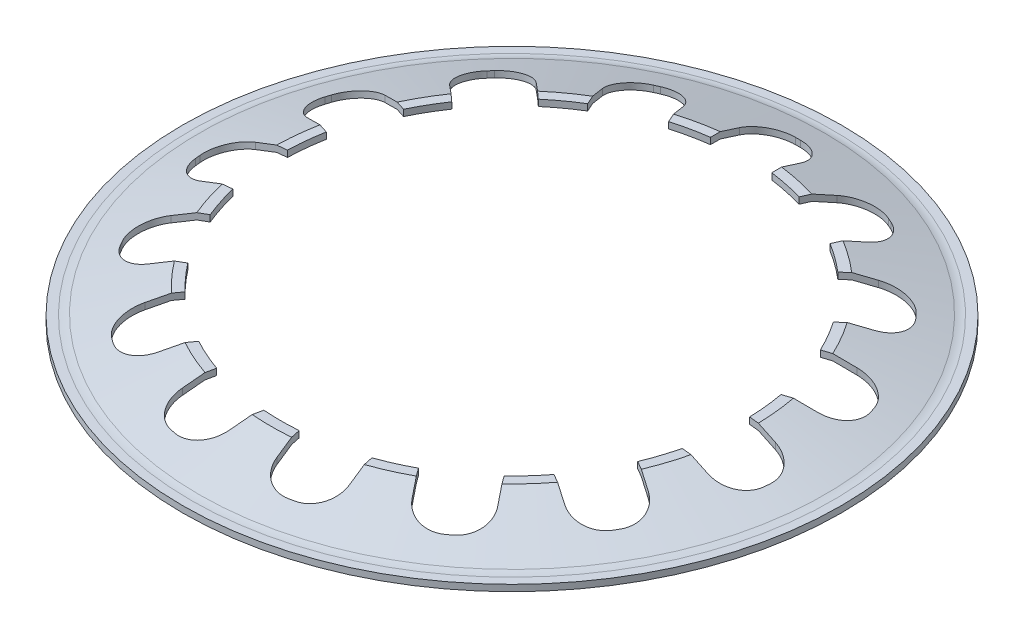
from build123d import *

# Parameters (mm, degrees)
CORTE_EXTRUS_O1_DEPTH = 92.413893911
FILETE1_R             = 5
FILETE2_R             = 5


with BuildPart() as part:
    # Esboço1 → Revolução1 (revolve)
    with BuildSketch(Plane.XY, mode=Mode.PRIVATE) as revolu_o1_sk:
        Polygon((47.15605335, 13.24375812), (62, 8.49375812), (64.5, 8.49375812), (64.5, 9.74375812), (62, 9.74375812), (47.15605335, 14.49375812), (45.25, 14.49375812), (45.25, 13.24375812), align=None)
    revolve(revolu_o1_sk.sketch.rotate(Axis((0, -50.328848283, 0), (0, 1, 0)), 90), axis=Axis((0, -50.328848283, 0), (0, 1, 0)))

    # Esboço3 → Corte-extrusão1 (cut, through all)
    with BuildSketch(Plane(origin=(0, 14.49375812, 0), x_dir=(1, 0, 0), z_dir=(0, 1, 0))):
        with BuildLine():
            Line((-0.5, 56), (0.500000001, 56))
            ThreePointArc((0.500000001, 56), (4.389087298, 54.389087297), (6.000000001, 50.5))
            Line((6.000000001, 50.5), (6.000000001, 40.826188888))
            Line((6.000000001, 40.826188888), (-6, 40.826188888))
            Line((-6, 40.826188888), (-6, 50.5))
            ThreePointArc((-6, 50.5), (-4.389087297, 54.389087297), (-0.5, 56))
        make_face()
        with BuildLine():
            Line((22.320479283, 51.36191395), (23.234024742, 50.955177306))
            ThreePointArc((23.234024742, 50.955177306), (26.131665551, 47.901701011), (26.021473222, 43.693625752))
            Line((26.021473222, 43.693625752), (22.086779765, 34.856159552))
            Line((22.086779765, 34.856159552), (11.124234272, 39.73699927))
            Line((11.124234272, 39.73699927), (15.058927729, 48.574465469))
            ThreePointArc((15.058927729, 48.574465469), (18.112404024, 51.472106278), (22.320479283, 51.36191395))
        make_face()
        with BuildLine():
            Line((41.281544924, 37.842886369), (41.950675531, 37.099741543))
            ThreePointArc((41.950675531, 37.099741543), (43.355841432, 33.131675448), (41.543597325, 29.332226667))
            Line((41.543597325, 29.332226667), (34.354554655, 22.859183572))
            Line((34.354554655, 22.859183572), (26.324987378, 31.776921479))
            Line((26.324987378, 31.776921479), (33.514030048, 38.249964574))
            ThreePointArc((33.514030048, 38.249964574), (37.482096143, 39.655130475), (41.281544924, 37.842886369))
        make_face()
        with BuildLine():
            Line((53.104656415, 17.780479943), (53.41367341, 16.829423426))
            ThreePointArc((53.41367341, 16.829423426), (53.083398453, 12.632882208), (49.882456039, 9.899019117))
            Line((49.882456039, 9.899019117), (40.682114944, 6.909647083))
            Line((40.682114944, 6.909647083), (36.973911011, 18.32232528))
            Line((36.973911011, 18.32232528), (46.174252107, 21.311697314))
            ThreePointArc((46.174252107, 21.311697314), (50.370793324, 20.981422357), (53.104656415, 17.780479943))
        make_face()
        with BuildLine():
            Line((55.745490372, -5.356332995), (55.640961909, -6.350854892))
            ThreePointArc((55.640961909, -6.350854892), (53.632353635, -10.050251132), (49.596184936, -11.245818768))
            Line((49.596184936, -11.245818768), (39.975367974, -10.234630159))
            Line((39.975367974, -10.234630159), (41.229709533, 1.699632587))
            Line((41.229709533, 1.699632587), (50.850526496, 0.688443977))
            ThreePointArc((50.850526496, 0.688443977), (54.549922736, -1.320164297), (55.745490372, -5.356332995))
        make_face()
        with BuildLine():
            Line((48.747422612, -27.566987298), (48.247422611, -28.433012703))
            ThreePointArc((48.247422611, -28.433012703), (44.907787639, -30.995604747), (40.734282891, -30.446152424))
            Line((40.734282891, -30.446152424), (32.356516716, -25.609246868))
            Line((32.356516716, -25.609246868), (38.356516717, -15.216942021))
            Line((38.356516717, -15.216942021), (46.734282891, -20.053847577))
            ThreePointArc((46.734282891, -20.053847577), (49.296874936, -23.39348255), (48.747422612, -27.566987298))
        make_face()
        with BuildLine():
            Line((33.320482626, -45.011059059), (32.51146563, -45.598844312))
            ThreePointArc((32.51146563, -45.598844312), (28.418257185, -46.581536716), (24.829053274, -44.38206973))
            Line((24.829053274, -44.38206973), (19.142929769, -36.55579214))
            Line((19.142929769, -36.55579214), (28.851133702, -29.502369112))
            Line((28.851133702, -29.502369112), (34.537257207, -37.328646702))
            ThreePointArc((34.537257207, -37.328646702), (35.519949611, -41.421855148), (33.320482626, -45.011059059))
        make_face()
        with BuildLine():
            Line((12.132128486, -54.672309796), (11.153980884, -54.880221487))
            ThreePointArc((11.153980884, -54.880221487), (7.014951892, -54.113097806), (4.630654781, -50.643923982))
            Line((4.630654781, -50.643923982), (2.619356356, -41.181508853))
            Line((2.619356356, -41.181508853), (14.357127566, -38.686568563))
            Line((14.357127566, -38.686568563), (16.368425991, -48.148983692))
            ThreePointArc((16.368425991, -48.148983692), (15.60130231, -52.288012684), (12.132128486, -54.672309796))
        make_face()
        with BuildLine():
            Line((-11.153980885, -54.880221487), (-12.132128487, -54.672309795))
            ThreePointArc((-12.132128487, -54.672309795), (-15.601302311, -52.288012684), (-16.368425992, -48.148983692))
            Line((-16.368425992, -48.148983692), (-14.357127567, -38.686568563))
            Line((-14.357127567, -38.686568563), (-2.619356357, -41.181508853))
            Line((-2.619356357, -41.181508853), (-4.630654782, -50.643923982))
            ThreePointArc((-4.630654782, -50.643923982), (-7.014951893, -54.113097806), (-11.153980885, -54.880221487))
        make_face()
        with BuildLine():
            Line((-32.511465631, -45.598844311), (-33.320482626, -45.011059058))
            ThreePointArc((-33.320482626, -45.011059058), (-35.519949612, -41.421855147), (-34.537257208, -37.328646702))
            Line((-34.537257208, -37.328646702), (-28.851133703, -29.502369111))
            Line((-28.851133703, -29.502369111), (-19.142929769, -36.55579214))
            Line((-19.142929769, -36.55579214), (-24.829053275, -44.38206973))
            ThreePointArc((-24.829053275, -44.38206973), (-28.418257186, -46.581536715), (-32.511465631, -45.598844311))
        make_face()
        with BuildLine():
            Line((-48.247422612, -28.433012702), (-48.747422612, -27.566987297))
            ThreePointArc((-48.747422612, -27.566987297), (-49.296874936, -23.393482549), (-46.734282892, -20.053847576))
            Line((-46.734282892, -20.053847576), (-38.356516717, -15.21694202))
            Line((-38.356516717, -15.21694202), (-32.356516717, -25.609246867))
            Line((-32.356516717, -25.609246867), (-40.734282891, -30.446152423))
            ThreePointArc((-40.734282891, -30.446152423), (-44.907787639, -30.995604746), (-48.247422612, -28.433012702))
        make_face()
        with BuildLine():
            Line((-55.640961909, -6.350854891), (-55.745490372, -5.356332994))
            ThreePointArc((-55.745490372, -5.356332994), (-54.549922736, -1.320164296), (-50.850526496, 0.688443978))
            Line((-50.850526496, 0.688443978), (-41.229709533, 1.699632588))
            Line((-41.229709533, 1.699632588), (-39.975367974, -10.234630158))
            Line((-39.975367974, -10.234630158), (-49.596184937, -11.245818767))
            ThreePointArc((-49.596184937, -11.245818767), (-53.632353635, -10.050251131), (-55.640961909, -6.350854891))
        make_face()
        with BuildLine():
            Line((-53.41367341, 16.829423427), (-53.104656415, 17.780479944))
            ThreePointArc((-53.104656415, 17.780479944), (-50.370793324, 20.981422358), (-46.174252106, 21.311697315))
            Line((-46.174252106, 21.311697315), (-36.973911011, 18.322325281))
            Line((-36.973911011, 18.322325281), (-40.682114944, 6.909647084))
            Line((-40.682114944, 6.909647084), (-49.882456039, 9.899019118))
            ThreePointArc((-49.882456039, 9.899019118), (-53.083398453, 12.632882209), (-53.41367341, 16.829423427))
        make_face()
        with BuildLine():
            Line((-41.95067553, 37.099741543), (-41.281544923, 37.84288637))
            ThreePointArc((-41.281544923, 37.84288637), (-37.482096142, 39.655130476), (-33.514030048, 38.249964575))
            Line((-33.514030048, 38.249964575), (-26.324987377, 31.776921479))
            Line((-26.324987377, 31.776921479), (-34.354554654, 22.859183573))
            Line((-34.354554654, 22.859183573), (-41.543597325, 29.332226668))
            ThreePointArc((-41.543597325, 29.332226668), (-43.355841431, 33.131675449), (-41.95067553, 37.099741543))
        make_face()
        with BuildLine():
            Line((-23.234024741, 50.955177306), (-22.320479282, 51.36191395))
            ThreePointArc((-22.320479282, 51.36191395), (-18.112404023, 51.472106279), (-15.058927729, 48.57446547))
            Line((-15.058927729, 48.57446547), (-11.124234271, 39.73699927))
            Line((-11.124234271, 39.73699927), (-22.086779764, 34.856159553))
            Line((-22.086779764, 34.856159553), (-26.021473221, 43.693625752))
            ThreePointArc((-26.021473221, 43.693625752), (-26.13166555, 47.901701012), (-23.234024741, 50.955177306))
        make_face()
    extrude(amount=-CORTE_EXTRUS_O1_DEPTH, mode=Mode.SUBTRACT)

    # Filete1
    filete1_edges = [part.edges().sort_by_distance(p)[0] for p in [
        (0, 9.74375812, 62),
    ]]
    fillet(filete1_edges, radius=FILETE1_R)

    # Filete2
    filete2_edges = [part.edges().sort_by_distance(p)[0] for p in [
        (0, 8.49375812, 62),
    ]]
    fillet(filete2_edges, radius=FILETE2_R)


solid = part.part
